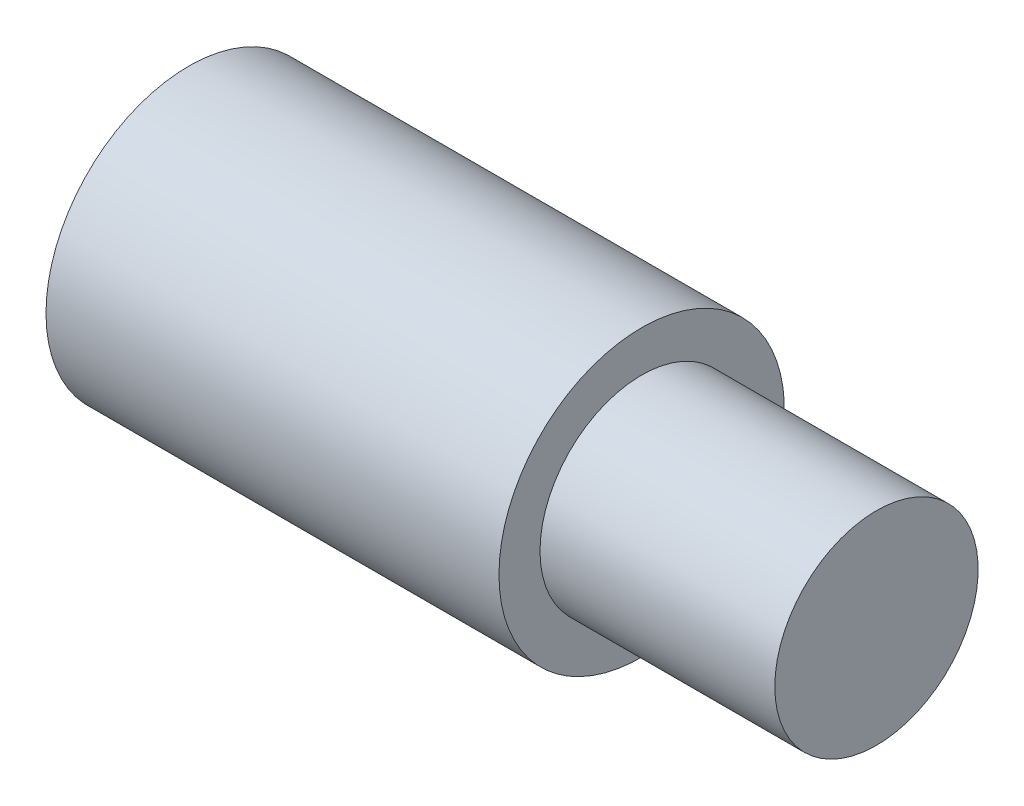
from build123d import *

# Parameters (mm, degrees)
SOCKET_1_SKETCH_W = 16.2
SOCKET_1_SKETCH_H = 3.175


with BuildPart() as part:
    # Conn_T4_MNPT Sketch → Conn_T4_MNPT (revolve)
    with BuildSketch(Plane.XY):
        Polygon((12.7, 0), (12.7, 5.5), (0, 5.5), (0, 7.72), (-24.5, 7.72), (-24.5, 0), align=None)
    revolve(axis=Axis((-1000, 0, 0), (1, 0, 0)))

    # Socket 1 Sketch → Socket 1 (revolve, cut)
    with BuildSketch(Plane.XY):
        with Locations((-17.4, 1.5875)):
            Rectangle(SOCKET_1_SKETCH_W, SOCKET_1_SKETCH_H)
    revolve(axis=Axis((-1000, 0, 0), (1, 0, 0)), mode=Mode.SUBTRACT)


solid = part.part
